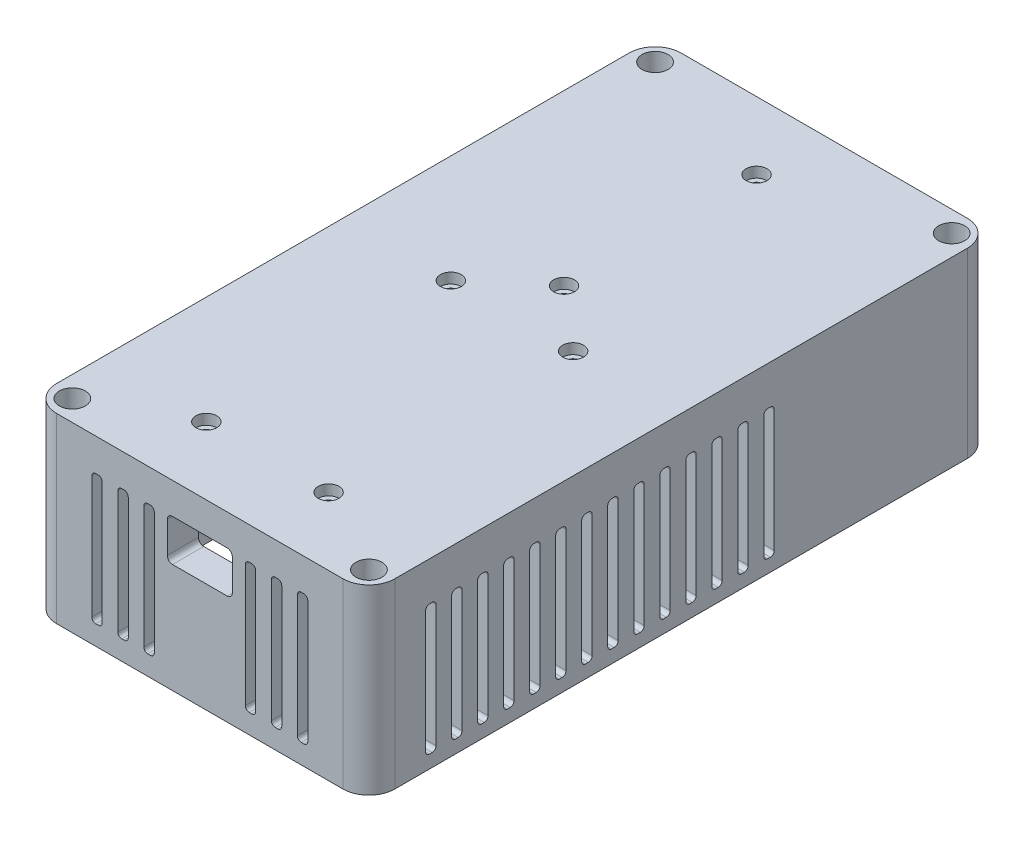
from build123d import *

# Parameters (mm, degrees)
BOSS_EXTRUDE1_DEPTH = 30
BOSS_EXTRUDE2_DEPTH = 5
CUT_EXTRUDE1_DEPTH  = 6
CUT_EXTRUDE2_REACH  = 131.156
SKETCH9_R           = 1.05
CUT_EXTRUDE4_DEPTH  = 35
SKETCH12_R          = 2.5
CUT_EXTRUDE5_DEPTH  = 30
SKETCH13_R          = 5.25
CUT_EXTRUDE6_DEPTH  = 6
SKETCH14_R          = 7
CUT_EXTRUDE7_DEPTH  = 3
CUT_EXTRUDE8_REACH  = 97.131
SKETCH18_R          = 1.05
CUT_EXTRUDE9_DEPTH  = 5
SKETCH20_R          = 1.05
CUT_EXTRUDE11_DEPTH = 5
SKETCH19_R          = 2
CUT_EXTRUDE10_DEPTH = 2


with BuildPart() as part:
    # Sketch1 → Boss-Extrude1 (new body)
    with BuildSketch(Plane(origin=(0, 0, 0), x_dir=(1, 0, 0), z_dir=(0, 1, 0))):
        with BuildLine():
            Line((-27.5, 60), (27.5, 60))
            ThreePointArc((27.5, 60), (31.035533906, 58.535533906), (32.5, 55))
            Line((32.5, 55), (32.5, -55))
            ThreePointArc((32.5, -55), (31.035533906, -58.535533906), (27.5, -60))
            Line((27.5, -60), (-27.5, -60))
            ThreePointArc((-27.5, -60), (-31.035533906, -58.535533906), (-32.5, -55))
            Line((-32.5, -55), (-32.5, 55))
            ThreePointArc((-32.5, 55), (-31.035533906, 58.535533906), (-27.5, 60))
        make_face()
        with BuildLine():
            Line((-26.5, 51.5), (-26.5, -51.5))
            ThreePointArc((-26.5, -51.5), (-25.767766953, -53.267766953), (-24, -54))
            Line((-24, -54), (24, -54))
            ThreePointArc((24, -54), (25.767766953, -53.267766953), (26.5, -51.5))
            Line((26.5, -51.5), (26.5, 51.5))
            ThreePointArc((26.5, 51.5), (25.767766953, 53.267766953), (24, 54))
            Line((24, 54), (-24, 54))
            ThreePointArc((-24, 54), (-25.767766953, 53.267766953), (-26.5, 51.5))
        make_face(mode=Mode.SUBTRACT)
    extrude(amount=BOSS_EXTRUDE1_DEPTH)

    # Sketch6 → Boss-Extrude2 (add)
    with BuildSketch(Plane(origin=(0, 30, 0), x_dir=(1, 0, 0), z_dir=(0, 1, 0))):
        with BuildLine():
            Line((-27.5, 60), (27.5, 60))
            ThreePointArc((27.5, 60), (31.035533906, 58.535533906), (32.5, 55))
            Line((32.5, 55), (32.5, -55))
            ThreePointArc((32.5, -55), (31.035533906, -58.535533906), (27.5, -60))
            Line((27.5, -60), (-27.5, -60))
            ThreePointArc((-27.5, -60), (-31.035533906, -58.535533906), (-32.5, -55))
            Line((-32.5, -55), (-32.5, 55))
            ThreePointArc((-32.5, 55), (-31.035533906, 58.535533906), (-27.5, 60))
        make_face()
    extrude(amount=BOSS_EXTRUDE2_DEPTH)

    # Sketch7 → Cut-Extrude1 (cut)
    with BuildSketch(Plane.XY.offset(60)):
        with BuildLine():
            Line((-5.25, 29), (5.25, 29))
            ThreePointArc((5.25, 29), (5.957106781, 28.707106781), (6.25, 28))
            Line((6.25, 28), (6.25, 22))
            ThreePointArc((6.25, 22), (5.957106781, 21.292893219), (5.25, 21))
            Line((5.25, 21), (-5.25, 21))
            ThreePointArc((-5.25, 21), (-5.957106781, 21.292893219), (-6.25, 22))
            Line((-6.25, 22), (-6.25, 28))
            ThreePointArc((-6.25, 28), (-5.957106781, 28.707106781), (-5.25, 29))
        make_face()
    extrude(amount=-CUT_EXTRUDE1_DEPTH, mode=Mode.SUBTRACT)

    # Cut-Extrude2: up to this face of the body (flat: up to its plane)
    cut_extrude2_end = Plane(part.part.faces().sort_by_distance((0, 17.5, -60))[0])
    # Sketch8 → Cut-Extrude2 (cut, up to the picked face)
    with BuildSketch(Plane.XY.offset(60), mode=Mode.PRIVATE) as cut_extrude2_sk1:
        with BuildLine():
            Line((-10, 28.75), (-9.5, 28.75))
            ThreePointArc((-9.5, 28.75), (-8.969669914, 28.530330086), (-8.75, 28))
            Line((-8.75, 28), (-8.75, 4.5))
            ThreePointArc((-8.75, 4.5), (-8.969669914, 3.969669914), (-9.5, 3.75))
            Line((-9.5, 3.75), (-10, 3.75))
            ThreePointArc((-10, 3.75), (-10.530330086, 3.969669914), (-10.75, 4.5))
            Line((-10.75, 4.5), (-10.75, 28))
            ThreePointArc((-10.75, 28), (-10.530330086, 28.530330086), (-10, 28.75))
        make_face()
    cut_extrude2_tool1 = split(extrude(cut_extrude2_sk1.sketch, amount=-CUT_EXTRUDE2_REACH, mode=Mode.PRIVATE), bisect_by=cut_extrude2_end, keep=Keep.BOTH, mode=Mode.PRIVATE)
    # Sketch8 → Cut-Extrude2 (cut, up to the picked face)
    with BuildSketch(Plane.XY.offset(60), mode=Mode.PRIVATE) as cut_extrude2_sk2:
        with BuildLine():
            Line((-15.75, 28), (-15.75, 4.5))
            ThreePointArc((-15.75, 4.5), (-15.530330086, 3.969669914), (-15, 3.75))
            Line((-15, 3.75), (-14.5, 3.75))
            ThreePointArc((-14.5, 3.75), (-13.969669914, 3.969669914), (-13.75, 4.5))
            Line((-13.75, 4.5), (-13.75, 28))
            ThreePointArc((-13.75, 28), (-13.969669914, 28.530330086), (-14.5, 28.75))
            Line((-14.5, 28.75), (-15, 28.75))
            ThreePointArc((-15, 28.75), (-15.530330086, 28.530330086), (-15.75, 28))
        make_face()
    cut_extrude2_tool2 = split(extrude(cut_extrude2_sk2.sketch, amount=-CUT_EXTRUDE2_REACH, mode=Mode.PRIVATE), bisect_by=cut_extrude2_end, keep=Keep.BOTH, mode=Mode.PRIVATE)
    # Sketch8 → Cut-Extrude2 (cut, up to the picked face)
    with BuildSketch(Plane.XY.offset(60), mode=Mode.PRIVATE) as cut_extrude2_sk3:
        with BuildLine():
            Line((-20.75, 28), (-20.75, 4.5))
            ThreePointArc((-20.75, 4.5), (-20.530330086, 3.969669914), (-20, 3.75))
            Line((-20, 3.75), (-19.5, 3.75))
            ThreePointArc((-19.5, 3.75), (-18.969669914, 3.969669914), (-18.75, 4.5))
            Line((-18.75, 4.5), (-18.75, 28))
            ThreePointArc((-18.75, 28), (-18.969669914, 28.530330086), (-19.5, 28.75))
            Line((-19.5, 28.75), (-20, 28.75))
            ThreePointArc((-20, 28.75), (-20.530330086, 28.530330086), (-20.75, 28))
        make_face()
    cut_extrude2_tool3 = split(extrude(cut_extrude2_sk3.sketch, amount=-CUT_EXTRUDE2_REACH, mode=Mode.PRIVATE), bisect_by=cut_extrude2_end, keep=Keep.BOTH, mode=Mode.PRIVATE)
    # Sketch8 → Cut-Extrude2 (cut, up to the picked face)
    with BuildSketch(Plane.XY.offset(60), mode=Mode.PRIVATE) as cut_extrude2_sk4:
        with BuildLine():
            Line((8.75, 28), (8.75, 4.5))
            ThreePointArc((8.75, 4.5), (8.969669914, 3.969669914), (9.5, 3.75))
            Line((9.5, 3.75), (10, 3.75))
            ThreePointArc((10, 3.75), (10.530330086, 3.969669914), (10.75, 4.5))
            Line((10.75, 4.5), (10.75, 28))
            ThreePointArc((10.75, 28), (10.530330086, 28.530330086), (10, 28.75))
            Line((10, 28.75), (9.5, 28.75))
            ThreePointArc((9.5, 28.75), (8.969669914, 28.530330086), (8.75, 28))
        make_face()
    cut_extrude2_tool4 = split(extrude(cut_extrude2_sk4.sketch, amount=-CUT_EXTRUDE2_REACH, mode=Mode.PRIVATE), bisect_by=cut_extrude2_end, keep=Keep.BOTH, mode=Mode.PRIVATE)
    # Sketch8 → Cut-Extrude2 (cut, up to the picked face)
    with BuildSketch(Plane.XY.offset(60), mode=Mode.PRIVATE) as cut_extrude2_sk5:
        with BuildLine():
            Line((13.75, 28), (13.75, 4.5))
            ThreePointArc((13.75, 4.5), (13.969669914, 3.969669914), (14.5, 3.75))
            Line((14.5, 3.75), (15, 3.75))
            ThreePointArc((15, 3.75), (15.530330086, 3.969669914), (15.75, 4.5))
            Line((15.75, 4.5), (15.75, 28))
            ThreePointArc((15.75, 28), (15.530330086, 28.530330086), (15, 28.75))
            Line((15, 28.75), (14.5, 28.75))
            ThreePointArc((14.5, 28.75), (13.969669914, 28.530330086), (13.75, 28))
        make_face()
    cut_extrude2_tool5 = split(extrude(cut_extrude2_sk5.sketch, amount=-CUT_EXTRUDE2_REACH, mode=Mode.PRIVATE), bisect_by=cut_extrude2_end, keep=Keep.BOTH, mode=Mode.PRIVATE)
    # Sketch8 → Cut-Extrude2 (cut, up to the picked face)
    with BuildSketch(Plane.XY.offset(60), mode=Mode.PRIVATE) as cut_extrude2_sk6:
        with BuildLine():
            Line((18.75, 28), (18.75, 4.5))
            ThreePointArc((18.75, 4.5), (18.969669914, 3.969669914), (19.5, 3.75))
            Line((19.5, 3.75), (20, 3.75))
            ThreePointArc((20, 3.75), (20.530330086, 3.969669914), (20.75, 4.5))
            Line((20.75, 4.5), (20.75, 28))
            ThreePointArc((20.75, 28), (20.530330086, 28.530330086), (20, 28.75))
            Line((20, 28.75), (19.5, 28.75))
            ThreePointArc((19.5, 28.75), (18.969669914, 28.530330086), (18.75, 28))
        make_face()
    cut_extrude2_tool6 = split(extrude(cut_extrude2_sk6.sketch, amount=-CUT_EXTRUDE2_REACH, mode=Mode.PRIVATE), bisect_by=cut_extrude2_end, keep=Keep.BOTH, mode=Mode.PRIVATE)
    add(cut_extrude2_tool1.solids().sort_by(Axis((-9.75, 16.25, 60), (0, 0, -1)))[0], mode=Mode.SUBTRACT)
    add(cut_extrude2_tool2.solids().sort_by(Axis((-14.75, 16.25, 60), (0, 0, -1)))[0], mode=Mode.SUBTRACT)
    add(cut_extrude2_tool3.solids().sort_by(Axis((-19.75, 16.25, 60), (0, 0, -1)))[0], mode=Mode.SUBTRACT)
    add(cut_extrude2_tool4.solids().sort_by(Axis((9.75, 16.25, 60), (0, 0, -1)))[0], mode=Mode.SUBTRACT)
    add(cut_extrude2_tool5.solids().sort_by(Axis((14.75, 16.25, 60), (0, 0, -1)))[0], mode=Mode.SUBTRACT)
    add(cut_extrude2_tool6.solids().sort_by(Axis((19.75, 16.25, 60), (0, 0, -1)))[0], mode=Mode.SUBTRACT)

    # Sketch9 → Cut-Extrude4 (cut)
    with BuildSketch(Plane.XZ):
        with Locations(Location((-28.5, 56, 0), (0, 0, 270))):
            Circle(SKETCH9_R)
        with Locations(Location((28.5, 56, 0), (0, 0, 270))):
            Circle(SKETCH9_R)
        with Locations(Location((28.5, -56, 0), (0, 0, 270))):
            Circle(SKETCH9_R)
        with Locations(Location((-28.5, -56, 0), (0, 0, 270))):
            Circle(SKETCH9_R)
    extrude(amount=-CUT_EXTRUDE4_DEPTH, mode=Mode.SUBTRACT)

    # Sketch12 → Cut-Extrude5 (cut)
    with BuildSketch(Plane(origin=(0, 35, 0), x_dir=(1, 0, 0), z_dir=(0, 1, 0))):
        with Locations(Location((-28.5, 56, 0), (0, 0, 270))):
            Circle(SKETCH12_R)
        with Locations(Location((28.5, 56, 0), (0, 0, 270))):
            Circle(SKETCH12_R)
        with Locations(Location((-28.5, -56, 0), (0, 0, 270))):
            Circle(SKETCH12_R)
        with Locations(Location((28.5, -56, 0), (0, 0, 270))):
            Circle(SKETCH12_R)
    extrude(amount=-CUT_EXTRUDE5_DEPTH, mode=Mode.SUBTRACT)

    # Sketch13 → Cut-Extrude6 (cut)
    with BuildSketch(Plane.ZY.offset(32.5)):
        with Locations((-36.723379956, 17.5)):
            Circle(SKETCH13_R)
    extrude(amount=-CUT_EXTRUDE6_DEPTH, mode=Mode.SUBTRACT)

    # Sketch14 → Cut-Extrude7 (cut)
    with BuildSketch(Plane.ZY.offset(32.5)):
        with Locations((-36.723379956, 17.5)):
            Circle(SKETCH14_R)
    extrude(amount=-CUT_EXTRUDE7_DEPTH, mode=Mode.SUBTRACT)

    # Cut-Extrude8: up to this face of the body (flat: up to its plane)
    cut_extrude8_end = Plane(part.part.faces().sort_by_distance((32.5, 17.5, 0))[0])
    # Sketch15 → Cut-Extrude8 (cut, up to the picked face)
    with BuildSketch(Plane.ZY.offset(32.5), mode=Mode.PRIVATE) as cut_extrude8_sk1:
        with BuildLine():
            Line((-17.149418812, 27.5), (-16.649418812, 27.5))
            ThreePointArc((-16.649418812, 27.5), (-16.119088726, 27.280330086), (-15.899418812, 26.75))
            Line((-15.899418812, 26.75), (-15.899418812, 3.25))
            ThreePointArc((-15.899418812, 3.25), (-16.119088726, 2.719669914), (-16.649418812, 2.5))
            Line((-16.649418812, 2.5), (-17.149418812, 2.5))
            ThreePointArc((-17.149418812, 2.5), (-17.679748898, 2.719669914), (-17.899418812, 3.25))
            Line((-17.899418812, 3.25), (-17.899418812, 26.75))
            ThreePointArc((-17.899418812, 26.75), (-17.679748898, 27.280330086), (-17.149418812, 27.5))
        make_face()
    cut_extrude8_tool1 = split(extrude(cut_extrude8_sk1.sketch, amount=-CUT_EXTRUDE8_REACH, mode=Mode.PRIVATE), bisect_by=cut_extrude8_end, keep=Keep.BOTH, mode=Mode.PRIVATE)
    # Sketch15 → Cut-Extrude8 (cut, up to the picked face)
    with BuildSketch(Plane.ZY.offset(32.5), mode=Mode.PRIVATE) as cut_extrude8_sk2:
        with BuildLine():
            Line((-12.899418812, 26.75), (-12.899418812, 3.25))
            ThreePointArc((-12.899418812, 3.25), (-12.679748898, 2.719669914), (-12.149418812, 2.5))
            Line((-12.149418812, 2.5), (-11.649418812, 2.5))
            ThreePointArc((-11.649418812, 2.5), (-11.119088726, 2.719669914), (-10.899418812, 3.25))
            Line((-10.899418812, 3.25), (-10.899418812, 26.75))
            ThreePointArc((-10.899418812, 26.75), (-11.119088726, 27.280330086), (-11.649418812, 27.5))
            Line((-11.649418812, 27.5), (-12.149418812, 27.5))
            ThreePointArc((-12.149418812, 27.5), (-12.679748898, 27.280330086), (-12.899418812, 26.75))
        make_face()
    cut_extrude8_tool2 = split(extrude(cut_extrude8_sk2.sketch, amount=-CUT_EXTRUDE8_REACH, mode=Mode.PRIVATE), bisect_by=cut_extrude8_end, keep=Keep.BOTH, mode=Mode.PRIVATE)
    # Sketch15 → Cut-Extrude8 (cut, up to the picked face)
    with BuildSketch(Plane.ZY.offset(32.5), mode=Mode.PRIVATE) as cut_extrude8_sk3:
        with BuildLine():
            Line((-7.899418812, 26.75), (-7.899418812, 3.25))
            ThreePointArc((-7.899418812, 3.25), (-7.679748898, 2.719669914), (-7.149418812, 2.5))
            Line((-7.149418812, 2.5), (-6.649418812, 2.5))
            ThreePointArc((-6.649418812, 2.5), (-6.119088726, 2.719669914), (-5.899418812, 3.25))
            Line((-5.899418812, 3.25), (-5.899418812, 26.75))
            ThreePointArc((-5.899418812, 26.75), (-6.119088726, 27.280330086), (-6.649418812, 27.5))
            Line((-6.649418812, 27.5), (-7.149418812, 27.5))
            ThreePointArc((-7.149418812, 27.5), (-7.679748898, 27.280330086), (-7.899418812, 26.75))
        make_face()
    cut_extrude8_tool3 = split(extrude(cut_extrude8_sk3.sketch, amount=-CUT_EXTRUDE8_REACH, mode=Mode.PRIVATE), bisect_by=cut_extrude8_end, keep=Keep.BOTH, mode=Mode.PRIVATE)
    # Sketch15 → Cut-Extrude8 (cut, up to the picked face)
    with BuildSketch(Plane.ZY.offset(32.5), mode=Mode.PRIVATE) as cut_extrude8_sk4:
        with BuildLine():
            Line((-2.899418812, 26.75), (-2.899418812, 3.25))
            ThreePointArc((-2.899418812, 3.25), (-2.679748898, 2.719669914), (-2.149418812, 2.5))
            Line((-2.149418812, 2.5), (-1.649418812, 2.5))
            ThreePointArc((-1.649418812, 2.5), (-1.119088726, 2.719669914), (-0.899418812, 3.25))
            Line((-0.899418812, 3.25), (-0.899418812, 26.75))
            ThreePointArc((-0.899418812, 26.75), (-1.119088726, 27.280330086), (-1.649418812, 27.5))
            Line((-1.649418812, 27.5), (-2.149418812, 27.5))
            ThreePointArc((-2.149418812, 27.5), (-2.679748898, 27.280330086), (-2.899418812, 26.75))
        make_face()
    cut_extrude8_tool4 = split(extrude(cut_extrude8_sk4.sketch, amount=-CUT_EXTRUDE8_REACH, mode=Mode.PRIVATE), bisect_by=cut_extrude8_end, keep=Keep.BOTH, mode=Mode.PRIVATE)
    # Sketch15 → Cut-Extrude8 (cut, up to the picked face)
    with BuildSketch(Plane.ZY.offset(32.5), mode=Mode.PRIVATE) as cut_extrude8_sk5:
        with BuildLine():
            Line((2.100581188, 26.75), (2.100581188, 3.25))
            ThreePointArc((2.100581188, 3.25), (2.320251102, 2.719669914), (2.850581188, 2.5))
            Line((2.850581188, 2.5), (3.350581188, 2.5))
            ThreePointArc((3.350581188, 2.5), (3.880911274, 2.719669914), (4.100581188, 3.25))
            Line((4.100581188, 3.25), (4.100581188, 26.75))
            ThreePointArc((4.100581188, 26.75), (3.880911274, 27.280330086), (3.350581188, 27.5))
            Line((3.350581188, 27.5), (2.850581188, 27.5))
            ThreePointArc((2.850581188, 27.5), (2.320251102, 27.280330086), (2.100581188, 26.75))
        make_face()
    cut_extrude8_tool5 = split(extrude(cut_extrude8_sk5.sketch, amount=-CUT_EXTRUDE8_REACH, mode=Mode.PRIVATE), bisect_by=cut_extrude8_end, keep=Keep.BOTH, mode=Mode.PRIVATE)
    # Sketch15 → Cut-Extrude8 (cut, up to the picked face)
    with BuildSketch(Plane.ZY.offset(32.5), mode=Mode.PRIVATE) as cut_extrude8_sk6:
        with BuildLine():
            Line((7.100581188, 26.75), (7.100581188, 3.25))
            ThreePointArc((7.100581188, 3.25), (7.320251102, 2.719669914), (7.850581188, 2.5))
            Line((7.850581188, 2.5), (8.350581188, 2.5))
            ThreePointArc((8.350581188, 2.5), (8.880911274, 2.719669914), (9.100581188, 3.25))
            Line((9.100581188, 3.25), (9.100581188, 26.75))
            ThreePointArc((9.100581188, 26.75), (8.880911274, 27.280330086), (8.350581188, 27.5))
            Line((8.350581188, 27.5), (7.850581188, 27.5))
            ThreePointArc((7.850581188, 27.5), (7.320251102, 27.280330086), (7.100581188, 26.75))
        make_face()
    cut_extrude8_tool6 = split(extrude(cut_extrude8_sk6.sketch, amount=-CUT_EXTRUDE8_REACH, mode=Mode.PRIVATE), bisect_by=cut_extrude8_end, keep=Keep.BOTH, mode=Mode.PRIVATE)
    # Sketch15 → Cut-Extrude8 (cut, up to the picked face)
    with BuildSketch(Plane.ZY.offset(32.5), mode=Mode.PRIVATE) as cut_extrude8_sk7:
        with BuildLine():
            Line((12.100581188, 26.75), (12.100581188, 3.25))
            ThreePointArc((12.100581188, 3.25), (12.320251102, 2.719669914), (12.850581188, 2.5))
            Line((12.850581188, 2.5), (13.350581188, 2.5))
            ThreePointArc((13.350581188, 2.5), (13.880911274, 2.719669914), (14.100581188, 3.25))
            Line((14.100581188, 3.25), (14.100581188, 26.75))
            ThreePointArc((14.100581188, 26.75), (13.880911274, 27.280330086), (13.350581188, 27.5))
            Line((13.350581188, 27.5), (12.850581188, 27.5))
            ThreePointArc((12.850581188, 27.5), (12.320251102, 27.280330086), (12.100581188, 26.75))
        make_face()
    cut_extrude8_tool7 = split(extrude(cut_extrude8_sk7.sketch, amount=-CUT_EXTRUDE8_REACH, mode=Mode.PRIVATE), bisect_by=cut_extrude8_end, keep=Keep.BOTH, mode=Mode.PRIVATE)
    # Sketch15 → Cut-Extrude8 (cut, up to the picked face)
    with BuildSketch(Plane.ZY.offset(32.5), mode=Mode.PRIVATE) as cut_extrude8_sk8:
        with BuildLine():
            Line((17.100581188, 26.75), (17.100581188, 3.25))
            ThreePointArc((17.100581188, 3.25), (17.320251102, 2.719669914), (17.850581188, 2.5))
            Line((17.850581188, 2.5), (18.350581188, 2.5))
            ThreePointArc((18.350581188, 2.5), (18.880911274, 2.719669914), (19.100581188, 3.25))
            Line((19.100581188, 3.25), (19.100581188, 26.75))
            ThreePointArc((19.100581188, 26.75), (18.880911274, 27.280330086), (18.350581188, 27.5))
            Line((18.350581188, 27.5), (17.850581188, 27.5))
            ThreePointArc((17.850581188, 27.5), (17.320251102, 27.280330086), (17.100581188, 26.75))
        make_face()
    cut_extrude8_tool8 = split(extrude(cut_extrude8_sk8.sketch, amount=-CUT_EXTRUDE8_REACH, mode=Mode.PRIVATE), bisect_by=cut_extrude8_end, keep=Keep.BOTH, mode=Mode.PRIVATE)
    # Sketch15 → Cut-Extrude8 (cut, up to the picked face)
    with BuildSketch(Plane.ZY.offset(32.5), mode=Mode.PRIVATE) as cut_extrude8_sk9:
        with BuildLine():
            Line((22.100581188, 26.75), (22.100581188, 3.25))
            ThreePointArc((22.100581188, 3.25), (22.320251102, 2.719669914), (22.850581188, 2.5))
            Line((22.850581188, 2.5), (23.350581188, 2.5))
            ThreePointArc((23.350581188, 2.5), (23.880911274, 2.719669914), (24.100581188, 3.25))
            Line((24.100581188, 3.25), (24.100581188, 26.75))
            ThreePointArc((24.100581188, 26.75), (23.880911274, 27.280330086), (23.350581188, 27.5))
            Line((23.350581188, 27.5), (22.850581188, 27.5))
            ThreePointArc((22.850581188, 27.5), (22.320251102, 27.280330086), (22.100581188, 26.75))
        make_face()
    cut_extrude8_tool9 = split(extrude(cut_extrude8_sk9.sketch, amount=-CUT_EXTRUDE8_REACH, mode=Mode.PRIVATE), bisect_by=cut_extrude8_end, keep=Keep.BOTH, mode=Mode.PRIVATE)
    # Sketch15 → Cut-Extrude8 (cut, up to the picked face)
    with BuildSketch(Plane.ZY.offset(32.5), mode=Mode.PRIVATE) as cut_extrude8_sk10:
        with BuildLine():
            Line((27.100581188, 26.75), (27.100581188, 3.25))
            ThreePointArc((27.100581188, 3.25), (27.320251102, 2.719669914), (27.850581188, 2.5))
            Line((27.850581188, 2.5), (28.350581188, 2.5))
            ThreePointArc((28.350581188, 2.5), (28.880911274, 2.719669914), (29.100581188, 3.25))
            Line((29.100581188, 3.25), (29.100581188, 26.75))
            ThreePointArc((29.100581188, 26.75), (28.880911274, 27.280330086), (28.350581188, 27.5))
            Line((28.350581188, 27.5), (27.850581188, 27.5))
            ThreePointArc((27.850581188, 27.5), (27.320251102, 27.280330086), (27.100581188, 26.75))
        make_face()
    cut_extrude8_tool10 = split(extrude(cut_extrude8_sk10.sketch, amount=-CUT_EXTRUDE8_REACH, mode=Mode.PRIVATE), bisect_by=cut_extrude8_end, keep=Keep.BOTH, mode=Mode.PRIVATE)
    # Sketch15 → Cut-Extrude8 (cut, up to the picked face)
    with BuildSketch(Plane.ZY.offset(32.5), mode=Mode.PRIVATE) as cut_extrude8_sk11:
        with BuildLine():
            Line((32.100581188, 26.75), (32.100581188, 3.25))
            ThreePointArc((32.100581188, 3.25), (32.320251102, 2.719669914), (32.850581188, 2.5))
            Line((32.850581188, 2.5), (33.350581188, 2.5))
            ThreePointArc((33.350581188, 2.5), (33.880911274, 2.719669914), (34.100581188, 3.25))
            Line((34.100581188, 3.25), (34.100581188, 26.75))
            ThreePointArc((34.100581188, 26.75), (33.880911274, 27.280330086), (33.350581188, 27.5))
            Line((33.350581188, 27.5), (32.850581188, 27.5))
            ThreePointArc((32.850581188, 27.5), (32.320251102, 27.280330086), (32.100581188, 26.75))
        make_face()
    cut_extrude8_tool11 = split(extrude(cut_extrude8_sk11.sketch, amount=-CUT_EXTRUDE8_REACH, mode=Mode.PRIVATE), bisect_by=cut_extrude8_end, keep=Keep.BOTH, mode=Mode.PRIVATE)
    # Sketch15 → Cut-Extrude8 (cut, up to the picked face)
    with BuildSketch(Plane.ZY.offset(32.5), mode=Mode.PRIVATE) as cut_extrude8_sk12:
        with BuildLine():
            Line((37.100581188, 26.75), (37.100581188, 3.25))
            ThreePointArc((37.100581188, 3.25), (37.320251102, 2.719669914), (37.850581188, 2.5))
            Line((37.850581188, 2.5), (38.350581188, 2.5))
            ThreePointArc((38.350581188, 2.5), (38.880911274, 2.719669914), (39.100581188, 3.25))
            Line((39.100581188, 3.25), (39.100581188, 26.75))
            ThreePointArc((39.100581188, 26.75), (38.880911274, 27.280330086), (38.350581188, 27.5))
            Line((38.350581188, 27.5), (37.850581188, 27.5))
            ThreePointArc((37.850581188, 27.5), (37.320251102, 27.280330086), (37.100581188, 26.75))
        make_face()
    cut_extrude8_tool12 = split(extrude(cut_extrude8_sk12.sketch, amount=-CUT_EXTRUDE8_REACH, mode=Mode.PRIVATE), bisect_by=cut_extrude8_end, keep=Keep.BOTH, mode=Mode.PRIVATE)
    # Sketch15 → Cut-Extrude8 (cut, up to the picked face)
    with BuildSketch(Plane.ZY.offset(32.5), mode=Mode.PRIVATE) as cut_extrude8_sk13:
        with BuildLine():
            Line((42.100581188, 26.75), (42.100581188, 3.25))
            ThreePointArc((42.100581188, 3.25), (42.320251102, 2.719669914), (42.850581188, 2.5))
            Line((42.850581188, 2.5), (43.350581188, 2.5))
            ThreePointArc((43.350581188, 2.5), (43.880911274, 2.719669914), (44.100581188, 3.25))
            Line((44.100581188, 3.25), (44.100581188, 26.75))
            ThreePointArc((44.100581188, 26.75), (43.880911274, 27.280330086), (43.350581188, 27.5))
            Line((43.350581188, 27.5), (42.850581188, 27.5))
            ThreePointArc((42.850581188, 27.5), (42.320251102, 27.280330086), (42.100581188, 26.75))
        make_face()
    cut_extrude8_tool13 = split(extrude(cut_extrude8_sk13.sketch, amount=-CUT_EXTRUDE8_REACH, mode=Mode.PRIVATE), bisect_by=cut_extrude8_end, keep=Keep.BOTH, mode=Mode.PRIVATE)
    # Sketch15 → Cut-Extrude8 (cut, up to the picked face)
    with BuildSketch(Plane.ZY.offset(32.5), mode=Mode.PRIVATE) as cut_extrude8_sk14:
        with BuildLine():
            Line((47.100581188, 26.75), (47.100581188, 3.25))
            ThreePointArc((47.100581188, 3.25), (47.320251102, 2.719669914), (47.850581188, 2.5))
            Line((47.850581188, 2.5), (48.350581188, 2.5))
            ThreePointArc((48.350581188, 2.5), (48.880911274, 2.719669914), (49.100581188, 3.25))
            Line((49.100581188, 3.25), (49.100581188, 26.75))
            ThreePointArc((49.100581188, 26.75), (48.880911274, 27.280330086), (48.350581188, 27.5))
            Line((48.350581188, 27.5), (47.850581188, 27.5))
            ThreePointArc((47.850581188, 27.5), (47.320251102, 27.280330086), (47.100581188, 26.75))
        make_face()
    cut_extrude8_tool14 = split(extrude(cut_extrude8_sk14.sketch, amount=-CUT_EXTRUDE8_REACH, mode=Mode.PRIVATE), bisect_by=cut_extrude8_end, keep=Keep.BOTH, mode=Mode.PRIVATE)
    add(cut_extrude8_tool1.solids().sort_by(Axis((-32.5, 15, -16.899419), (1, 0, 0)))[0], mode=Mode.SUBTRACT)
    add(cut_extrude8_tool2.solids().sort_by(Axis((-32.5, 15, -11.899419), (1, 0, 0)))[0], mode=Mode.SUBTRACT)
    add(cut_extrude8_tool3.solids().sort_by(Axis((-32.5, 15, -6.899419), (1, 0, 0)))[0], mode=Mode.SUBTRACT)
    add(cut_extrude8_tool4.solids().sort_by(Axis((-32.5, 15, -1.899419), (1, 0, 0)))[0], mode=Mode.SUBTRACT)
    add(cut_extrude8_tool5.solids().sort_by(Axis((-32.5, 15, 3.100581), (1, 0, 0)))[0], mode=Mode.SUBTRACT)
    add(cut_extrude8_tool6.solids().sort_by(Axis((-32.5, 15, 8.100581), (1, 0, 0)))[0], mode=Mode.SUBTRACT)
    add(cut_extrude8_tool7.solids().sort_by(Axis((-32.5, 15, 13.100581), (1, 0, 0)))[0], mode=Mode.SUBTRACT)
    add(cut_extrude8_tool8.solids().sort_by(Axis((-32.5, 15, 18.100581), (1, 0, 0)))[0], mode=Mode.SUBTRACT)
    add(cut_extrude8_tool9.solids().sort_by(Axis((-32.5, 15, 23.100581), (1, 0, 0)))[0], mode=Mode.SUBTRACT)
    add(cut_extrude8_tool10.solids().sort_by(Axis((-32.5, 15, 28.100581), (1, 0, 0)))[0], mode=Mode.SUBTRACT)
    add(cut_extrude8_tool11.solids().sort_by(Axis((-32.5, 15, 33.100581), (1, 0, 0)))[0], mode=Mode.SUBTRACT)
    add(cut_extrude8_tool12.solids().sort_by(Axis((-32.5, 15, 38.100581), (1, 0, 0)))[0], mode=Mode.SUBTRACT)
    add(cut_extrude8_tool13.solids().sort_by(Axis((-32.5, 15, 43.100581), (1, 0, 0)))[0], mode=Mode.SUBTRACT)
    add(cut_extrude8_tool14.solids().sort_by(Axis((-32.5, 15, 48.100581), (1, 0, 0)))[0], mode=Mode.SUBTRACT)

    # Sketch18 → Cut-Extrude9 (cut)
    with BuildSketch(Plane.XZ.offset(-30)):
        with Locations(Location((-11.75, 47, 0), (0, 0, 270))):
            Circle(SKETCH18_R)
        with Locations(Location((11.75, 47, 0), (0, 0, 270))):
            Circle(SKETCH18_R)
        with Locations(Location((-11.75, 0, 0), (0, 0, 270))):
            Circle(SKETCH18_R)
        with Locations(Location((11.75, 0, 0), (0, 0, 270))):
            Circle(SKETCH18_R)
    extrude(amount=-CUT_EXTRUDE9_DEPTH, mode=Mode.SUBTRACT)

    # Sketch20 → Cut-Extrude11 (cut)
    with BuildSketch(Plane.XZ.offset(-30)):
        with Locations(Location((0, -10, 0), (0, 0, 270))):
            Circle(SKETCH20_R)
        with Locations(Location((0, -47, 0), (0, 0, 270))):
            Circle(SKETCH20_R)
    extrude(amount=-CUT_EXTRUDE11_DEPTH, mode=Mode.SUBTRACT)

    # Sketch19 → Cut-Extrude10 (cut)
    with BuildSketch(Plane(origin=(0, 35, 0), x_dir=(1, 0, 0), z_dir=(0, 1, 0))):
        with Locations(Location((-11.75, 0, 0), (0, 0, 270))):
            Circle(SKETCH19_R)
        with Locations(Location((11.75, 0, 0), (0, 0, 270))):
            Circle(SKETCH19_R)
        with Locations(Location((11.75, -47, 0), (0, 0, 270))):
            Circle(SKETCH19_R)
        with Locations(Location((-11.75, -47, 0), (0, 0, 270))):
            Circle(SKETCH19_R)
        with Locations(Location((0, 10, 0), (0, 0, 270))):
            Circle(SKETCH19_R)
        with Locations(Location((0, 47, 0), (0, 0, 270))):
            Circle(SKETCH19_R)
    extrude(amount=-CUT_EXTRUDE10_DEPTH, mode=Mode.SUBTRACT)


solid = part.part
